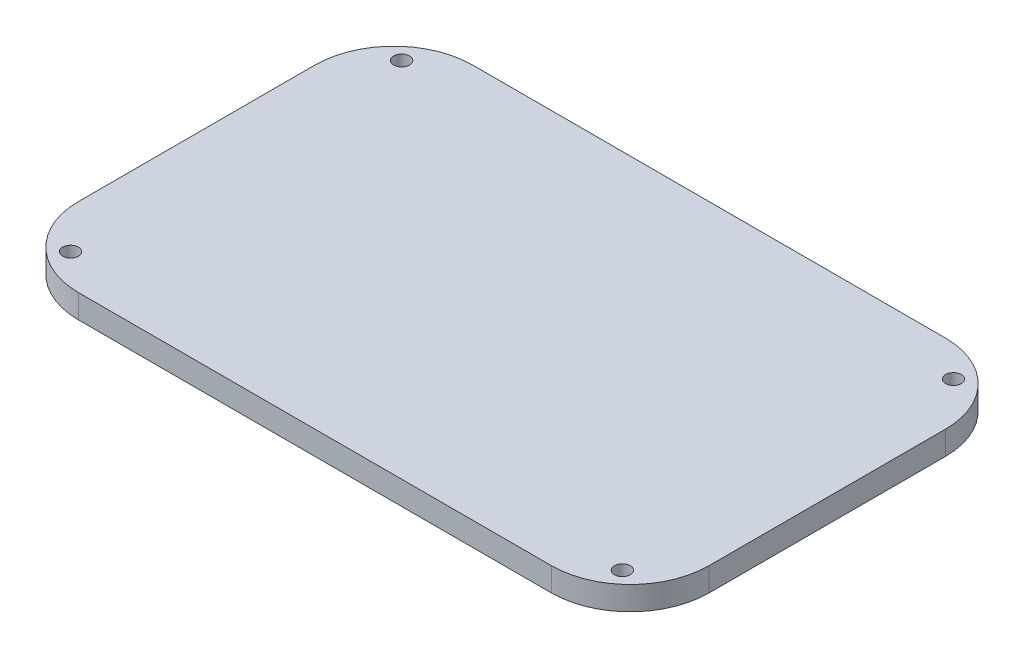
from build123d import *

# Parameters (mm, degrees)
SKETCH1_W           = 80
SKETCH1_H           = 50
BOSS_EXTRUDE1_DEPTH = 3
FILLET1_R           = 10
SKETCH2_R           = 1
CUT_EXTRUDE1_DEPTH  = 5


with BuildPart() as part:
    # Sketch1 → Boss-Extrude1 (new body)
    with BuildSketch(Plane(origin=(0, 0, 0), x_dir=(1, 0, 0), z_dir=(0, 1, 0))):
        Rectangle(SKETCH1_W, SKETCH1_H)
    extrude(amount=BOSS_EXTRUDE1_DEPTH)

    # Fillet1
    fillet1_edges = [part.edges().sort_by_distance(p)[0] for p in [
        (-40, 1.5, -25),
        (40, 1.5, -25),
        (40, 1.5, 25),
        (-40, 1.5, 25),
    ]]
    fillet(fillet1_edges, radius=FILLET1_R)

    # Sketch2 → Cut-Extrude1 (cut)
    with BuildSketch(Plane(origin=(0, 3, 0), x_dir=(1, 0, 0), z_dir=(0, 1, 0))):
        with Locations(Location((-35, 21, 0), (0, 0, 270))):
            Circle(SKETCH2_R)
        with Locations(Location((35, 21, 0), (0, 0, 90))):
            Circle(SKETCH2_R)
        with Locations(Location((35, -21, 0), (0, 0, 270))):
            Circle(SKETCH2_R)
        with Locations(Location((-35, -21, 0), (0, 0, 90))):
            Circle(SKETCH2_R)
    extrude(amount=-CUT_EXTRUDE1_DEPTH, mode=Mode.SUBTRACT)


solid = part.part
